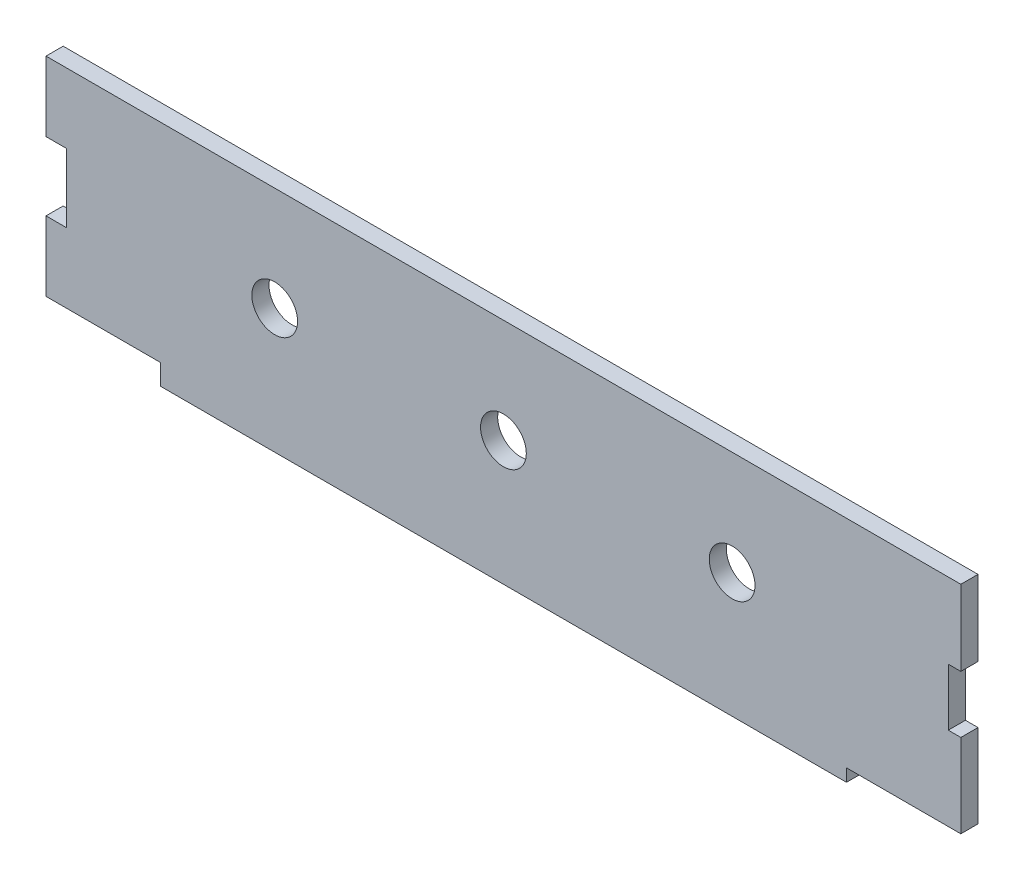
from build123d import *

# Parameters (mm, degrees)
CROQUIS1_R              = 2
SALIENTE_EXTRUIR1_DEPTH = 1.5


with BuildPart() as part:
    # Croquis1 → Saliente-Extruir1 (new body)
    with BuildSketch(Plane.XY):
        Polygon((-40, 9.1), (40, 9.1), (40, 2.5), (38.9, 2.5), (38.9, -2.5), (40, -2.5), (40, -9.8), (30, -9.8), (30, -10.9), (-30, -10.9), (-30, -9.1), (-40, -9.1), (-40, -3), (-38.2, -3), (-38.2, 3), (-40, 3), align=None)
        with Locations((20, 0)):
            Circle(CROQUIS1_R, mode=Mode.SUBTRACT)
        Circle(CROQUIS1_R, mode=Mode.SUBTRACT)
        with Locations((-20, 0)):
            Circle(CROQUIS1_R, mode=Mode.SUBTRACT)
    extrude(amount=SALIENTE_EXTRUIR1_DEPTH)


solid = part.part
